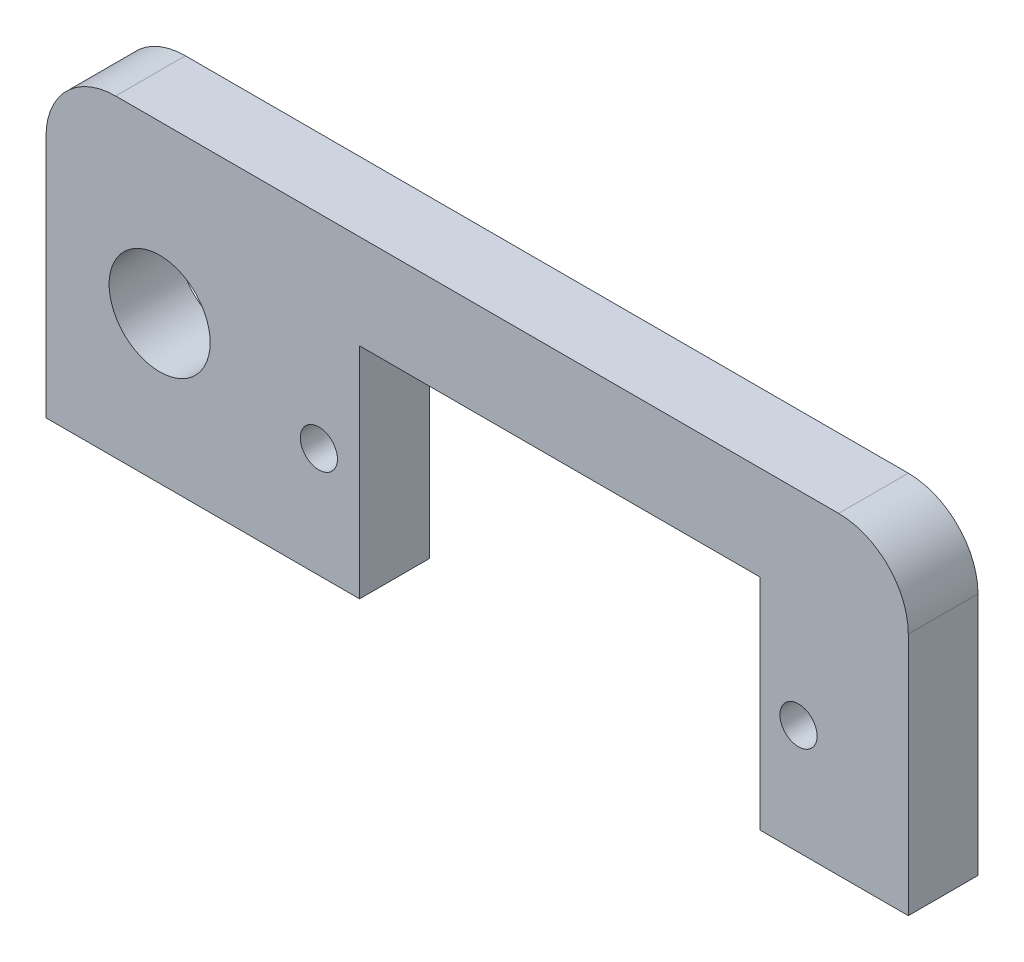
from build123d import *

# Parameters (mm, degrees)
BOSS_EXTRUDE1_DEPTH = 4
SKETCH2_R           = 1.0668
SKETCH2_R_2         = 2.9
CUT_EXTRUDE1_DEPTH  = 4


with BuildPart() as part:
    # Sketch1 → Boss-Extrude1 (new body)
    with BuildSketch(Plane.XY):
        with BuildLine():
            Line((-18, 0), (0, 0))
            Line((0, 0), (0, 12.58))
            Line((0, 12.58), (23, 12.58))
            Line((23, 12.58), (23, 0))
            Line((23, 0), (31.5, 0))
            Line((31.5, 0), (31.5, 14))
            ThreePointArc((31.5, 14), (30.328427125, 16.828427125), (27.5, 18))
            Line((27.5, 18), (-14, 18))
            ThreePointArc((-14, 18), (-16.828427125, 16.828427125), (-18, 14))
            Line((-18, 14), (-18, 0))
        make_face()
    extrude(amount=BOSS_EXTRUDE1_DEPTH)

    # Sketch2 → Cut-Extrude1 (cut)
    with BuildSketch(Plane.XY.offset(4)):
        with Locations((25.1968, 6.3119)):
            Circle(SKETCH2_R)
        with Locations((-2.3368, 6.3119)):
            Circle(SKETCH2_R)
        with Locations((-11.476, 8.45)):
            Circle(SKETCH2_R_2)
    extrude(amount=-CUT_EXTRUDE1_DEPTH, mode=Mode.SUBTRACT)


solid = part.part
